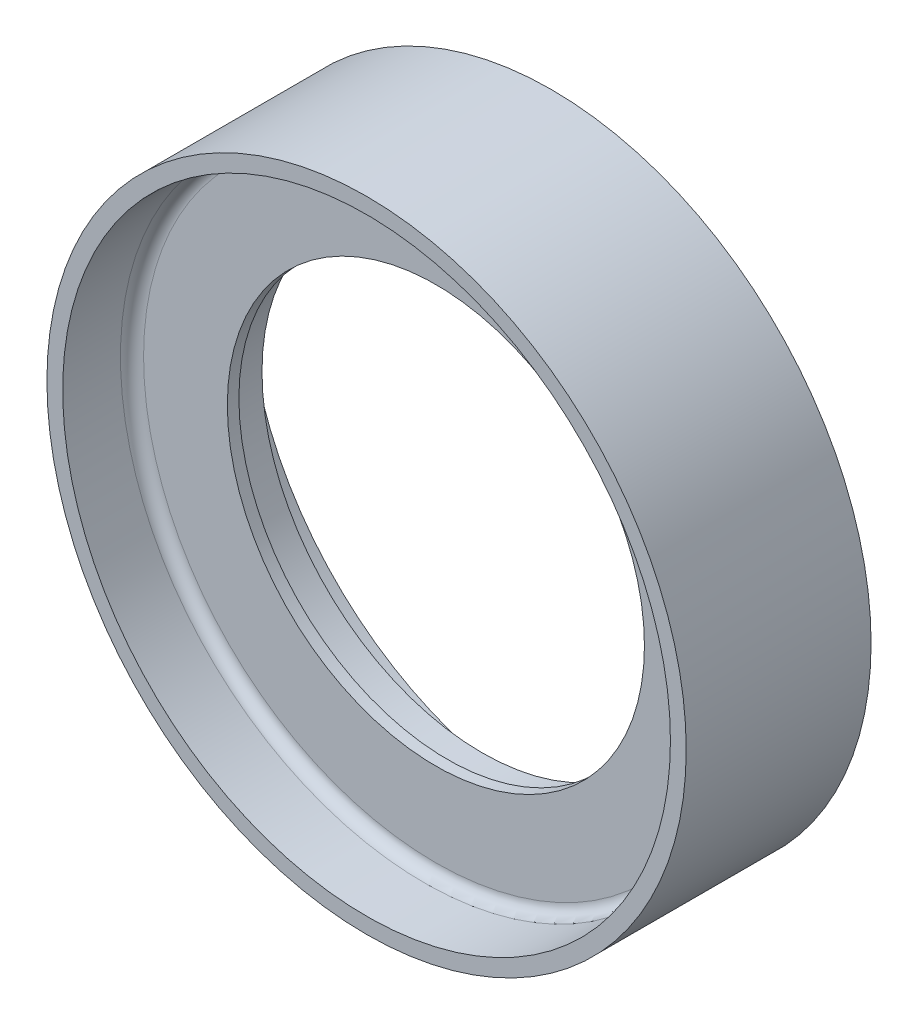
from build123d import *

# Parameters (mm, degrees)
SKETCH1_R           = 13.8327
SKETCH1_R_2         = 13.15
BOSS_EXTRUDE1_DEPTH = 3
BOSS_EXTRUDE2_START = 2
SKETCH2_R           = 13.8327
SKETCH2_R_2         = 9.025
BOSS_EXTRUDE2_DEPTH = 2
BOSS_EXTRUDE3_START = 3
SKETCH3_R           = 13.8327
SKETCH3_R_2         = 13.15
BOSS_EXTRUDE3_DEPTH = 3
FILLET1_R           = 0.5
SKETCH4_R           = 9.525
CUT_EXTRUDE2_DEPTH  = 1.5


with BuildPart() as part:
    # Sketch1 → Boss-Extrude1 (new body)
    with BuildSketch(Plane.XY):
        Circle(SKETCH1_R)
        Circle(SKETCH1_R_2, mode=Mode.SUBTRACT)
    extrude(amount=-BOSS_EXTRUDE1_DEPTH)

    # Sketch2 → Boss-Extrude2 (add)
    with BuildSketch(Plane.XY.offset(BOSS_EXTRUDE2_START)):
        Circle(SKETCH2_R)
        Circle(SKETCH2_R_2, mode=Mode.SUBTRACT)
    extrude(amount=-BOSS_EXTRUDE2_DEPTH)

    # Sketch3 → Boss-Extrude3 (add)
    with BuildSketch(Plane.XY.offset(2).offset(BOSS_EXTRUDE3_START)):
        Circle(SKETCH3_R)
        Circle(SKETCH3_R_2, mode=Mode.SUBTRACT)
    extrude(amount=-BOSS_EXTRUDE3_DEPTH)

    # Fillet1
    fillet1_edges = [part.edges().sort_by_distance(p)[0] for p in [
        (-13.15, 0, 0),
        (-13.15, 0, 2),
    ]]
    fillet(fillet1_edges, radius=FILLET1_R)

    # Sketch4 → Cut-Extrude2 (cut)
    with BuildSketch(Plane(origin=(0, 0, 0), x_dir=(-1, 0, 0), z_dir=(0, 0, -1))):
        Circle(SKETCH4_R)
    extrude(amount=-CUT_EXTRUDE2_DEPTH, mode=Mode.SUBTRACT)


solid = part.part
